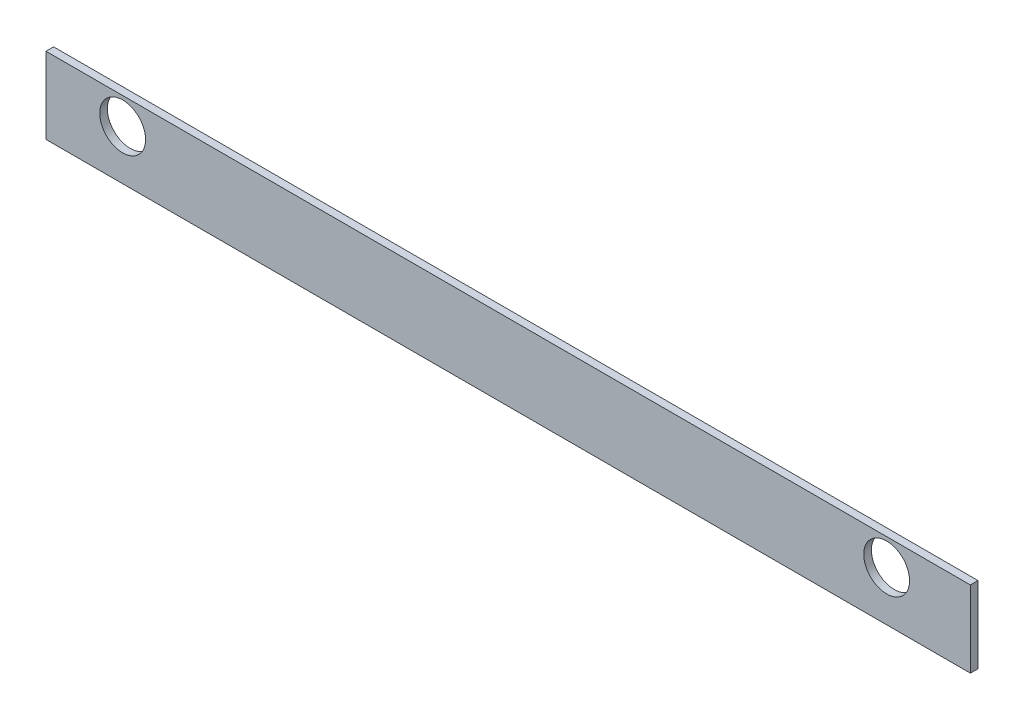
from build123d import *

# Parameters (mm, degrees)
SKETCH1_W           = 1209.884394494
SKETCH1_H           = 100
SKETCH1_R           = 30
BOSS_EXTRUDE1_DEPTH = 10


with BuildPart() as part:
    # Sketch1 → Boss-Extrude1 (new body)
    with BuildSketch(Plane.XY):
        with Locations((497.769221224, -46.191964707)):
            Rectangle(SKETCH1_W, SKETCH1_H)
        with Locations((993.169555768, -31.191964707)):
            Circle(SKETCH1_R, mode=Mode.SUBTRACT)
        with Locations((-6.830444232, -31.191964707)):
            Circle(SKETCH1_R, mode=Mode.SUBTRACT)
    extrude(amount=BOSS_EXTRUDE1_DEPTH)


solid = part.part
